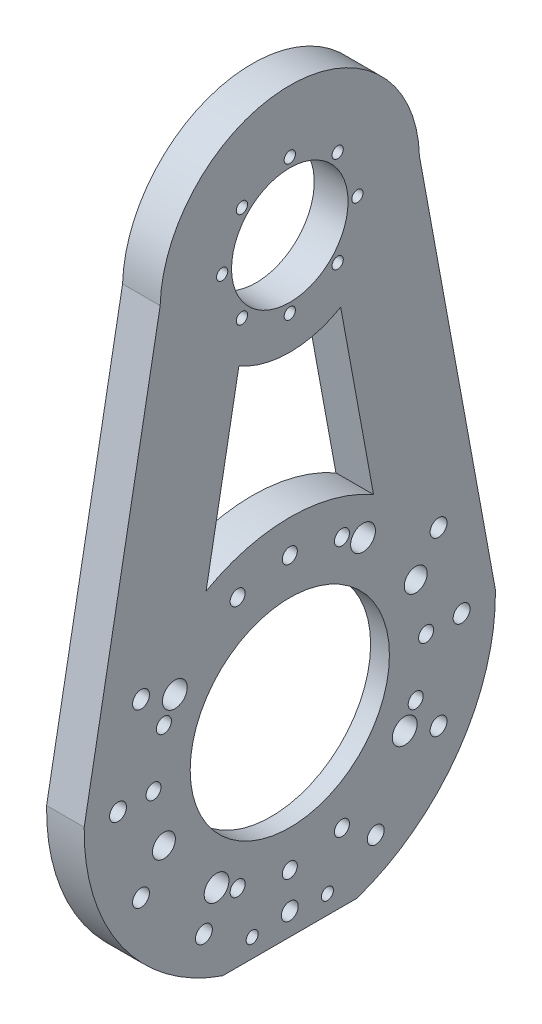
from build123d import *

# Parameters (mm, degrees)
SKETCH2_R                       = 40.5
SKETCH2_R_2                     = 15.5
BOSS_EXTRUDE1_DEPTH             = 5
BOSS_EXTRUDE2_START             = -5
SKETCH2_5_R                     = 40.5
SKETCH2_5_R_2                   = 15.5
BOSS_EXTRUDE2_DEPTH             = 5
FILLET3_R                       = 1
SKETCH12_R                      = 1.5
CUT_EXTRUDE12_DEPTH             = 191.422110061
CIRPATTERN1_COUNT               = 8
SKETCH13_R                      = 21.5
CUT_EXTRUDE13_DEPTH             = 1
CUT_EXTRUDE16_DEPTH             = 10
SKETCH16_W                      = 105.253324721
SKETCH16_H                      = 10.065806818
CUT_EXTRUDE17_DEPTH             = 10
CUT_EXTRUDE20_DEPTH             = 155.830035846
SKETCH29_R                      = 1.6
CUT_EXTRUDE21_DEPTH             = 10
SKETCH31_R                      = 2.25
CUT_EXTRUDE22_DEPTH             = 10
CIRPATTERN2_COUNT               = 5
CIRPATTERN2_ANGLE               = 120
CIRPATTERN2_THE_OTHER_WAY_COUNT = 5
CIRPATTERN2_THE_OTHER_WAY_ANGLE = 120


with BuildPart() as part:
    # Sketch2 → Boss-Extrude1 (new body)
    # profile 1 of 2: a face of its own
    with BuildSketch(Plane(origin=(0, 0, 0), x_dir=(0, 0, -1), z_dir=(1, 0, 0))):
        with BuildLine():
            Line((-67.7, 110), (-67.7, 0))
            Line((-67.7, 0), (-67.7, -68))
            Line((-67.7, -68), (67.7, -68))
            Line((67.7, -68), (67.7, 10))
            Line((67.7, 10), (67.7, 110))
            ThreePointArc((67.7, 110), (0, 177.7), (-67.7, 110))
        make_face()
        Circle(SKETCH2_R, mode=Mode.SUBTRACT)
        with Locations((0, 110)):
            Circle(SKETCH2_R_2, mode=Mode.SUBTRACT)
    # profile 2 of 2: a face of its own
    with BuildSketch(Plane(origin=(0, 0, 0), x_dir=(0, 0, -1), z_dir=(1, 0, 0))):
        Circle(SKETCH2_R)
        with BuildLine():
            ThreePointArc((-17.143658425, -32.906392289), (-21.81056318, -32.906392289), (-21.81056318, -28.239487533))
            ThreePointArc((-21.81056318, -28.239487533), (-17.143658425, -28.239487533), (-17.143658425, -32.906392289))
        make_face(mode=Mode.SUBTRACT)
        with BuildLine():
            ThreePointArc((-35.647308736, -11.715598741), (-31.333957371, -11.715598741), (-31.333957371, -16.028950106))
            ThreePointArc((-31.333957371, -16.028950106), (-35.647308736, -16.028950106), (-35.647308736, -11.715598741))
        make_face(mode=Mode.SUBTRACT)
        with BuildLine():
            ThreePointArc((-12.458060861, -34.904846616), (-15.286487986, -34.904846616), (-15.286487986, -32.076419491))
            ThreePointArc((-15.286487986, -32.076419491), (-12.458060861, -32.076419491), (-12.458060861, -34.904846616))
        make_face(mode=Mode.SUBTRACT)
        with BuildLine():
            ThreePointArc((-37.664213562, 1.414213562), (-34.835786438, 1.414213562), (-34.835786438, -1.414213562))
            ThreePointArc((-34.835786438, -1.414213562), (-37.664213562, -1.414213562), (-37.664213562, 1.414213562))
        make_face(mode=Mode.SUBTRACT)
        with BuildLine():
            ThreePointArc((-32.076419491, 12.458060861), (-34.904846616, 12.458060861), (-34.904846616, 15.286487986))
            ThreePointArc((-34.904846616, 15.286487986), (-32.076419491, 15.286487986), (-32.076419491, 12.458060861))
        make_face(mode=Mode.SUBTRACT)
        with BuildLine():
            ThreePointArc((-28.239487533, 17.143658425), (-32.906392289, 17.143658425), (-32.906392289, 21.81056318))
            ThreePointArc((-32.906392289, 21.81056318), (-28.239487533, 21.81056318), (-28.239487533, 17.143658425))
        make_face(mode=Mode.SUBTRACT)
        with BuildLine():
            ThreePointArc((-15.286487986, 34.904846616), (-12.458060861, 34.904846616), (-12.458060861, 32.076419491))
            ThreePointArc((-12.458060861, 32.076419491), (-15.286487986, 32.076419491), (-15.286487986, 34.904846616))
        make_face(mode=Mode.SUBTRACT)
        with BuildLine():
            ThreePointArc((-1.414213562, 37.664213562), (1.414213562, 37.664213562), (1.414213562, 34.835786438))
            ThreePointArc((1.414213562, 34.835786438), (-1.414213562, 34.835786438), (-1.414213562, 37.664213562))
        make_face(mode=Mode.SUBTRACT)
        with BuildLine():
            ThreePointArc((-1.414213562, -34.835786438), (1.414213562, -34.835786438), (1.414213562, -37.664213562))
            ThreePointArc((1.414213562, -37.664213562), (-1.414213562, -37.664213562), (-1.414213562, -34.835786438))
        make_face(mode=Mode.SUBTRACT)
        with BuildLine():
            ThreePointArc((12.458060861, -32.076419491), (15.286487986, -32.076419491), (15.286487986, -34.904846616))
            ThreePointArc((15.286487986, -34.904846616), (12.458060861, -34.904846616), (12.458060861, -32.076419491))
        make_face(mode=Mode.SUBTRACT)
        with BuildLine():
            ThreePointArc((32.906392289, -21.81056318), (28.239487533, -21.81056318), (28.239487533, -17.143658425))
            ThreePointArc((28.239487533, -17.143658425), (32.906392289, -17.143658425), (32.906392289, -21.81056318))
        make_face(mode=Mode.SUBTRACT)
        with BuildLine():
            ThreePointArc((34.904846616, -15.286487986), (32.076419491, -15.286487986), (32.076419491, -12.458060861))
            ThreePointArc((32.076419491, -12.458060861), (34.904846616, -12.458060861), (34.904846616, -15.286487986))
        make_face(mode=Mode.SUBTRACT)
        with BuildLine():
            ThreePointArc((16.292073099, 20.900199859), (20.900199859, -16.292073099), (-16.292073099, -20.900199859))
            ThreePointArc((-16.292073099, -20.900199859), (-20.900199859, 16.292073099), (16.292073099, 20.900199859))
        make_face(mode=Mode.SUBTRACT)
        with BuildLine():
            ThreePointArc((35.647308736, 11.715598741), (31.333957371, 11.715598741), (31.333957371, 16.028950106))
            ThreePointArc((31.333957371, 16.028950106), (35.647308736, 16.028950106), (35.647308736, 11.715598741))
        make_face(mode=Mode.SUBTRACT)
        with BuildLine():
            ThreePointArc((12.458060861, 34.904846616), (15.286487986, 34.904846616), (15.286487986, 32.076419491))
            ThreePointArc((15.286487986, 32.076419491), (12.458060861, 32.076419491), (12.458060861, 34.904846616))
        make_face(mode=Mode.SUBTRACT)
        with BuildLine():
            ThreePointArc((21.81056318, 28.239487533), (17.143658425, 28.239487533), (17.143658425, 32.906392289))
            ThreePointArc((17.143658425, 32.906392289), (21.81056318, 32.906392289), (21.81056318, 28.239487533))
        make_face(mode=Mode.SUBTRACT)
        with BuildLine():
            ThreePointArc((34.835786438, 1.414213562), (37.664213562, 1.414213562), (37.664213562, -1.414213562))
            ThreePointArc((37.664213562, -1.414213562), (34.835786438, -1.414213562), (34.835786438, 1.414213562))
        make_face(mode=Mode.SUBTRACT)
    extrude(amount=BOSS_EXTRUDE1_DEPTH)

    # Sketch2<5> → Boss-Extrude2 (add)
    with BuildSketch(Plane(origin=(0, 0, 0), x_dir=(0, 0, -1), z_dir=(1, 0, 0)).offset(BOSS_EXTRUDE2_START)):
        with BuildLine():
            Line((-67.7, 110), (-67.7, 0))
            Line((-67.7, 0), (-67.7, -68))
            Line((-67.7, -68), (67.7, -68))
            Line((67.7, -68), (67.7, 10))
            Line((67.7, 10), (67.7, 110))
            ThreePointArc((67.7, 110), (0, 177.7), (-67.7, 110))
        make_face()
        Circle(SKETCH2_5_R, mode=Mode.SUBTRACT)
        with Locations((0, 110)):
            Circle(SKETCH2_5_R_2, mode=Mode.SUBTRACT)
    extrude(amount=BOSS_EXTRUDE2_DEPTH)

    # Fillet3
    fillet3_edges = [part.edges().sort_by_distance(p)[0] for p in [
        (-5, 0, 40.5),
    ]]
    fillet(fillet3_edges, radius=FILLET3_R)

    # Sketch12 → Cut-Extrude12 (cut, through all)
    with BuildSketch(Plane.ZY.offset(5)):
        with Locations((-0.00151734, 127.999999936)):
            Circle(SKETCH12_R)
    cut_extrude12 = extrude(amount=-CUT_EXTRUDE12_DEPTH, mode=Mode.SUBTRACT)

    # CirPattern1: Cut-Extrude12 ×8 about axis
    cirpattern1_axis = Axis((0, 110, 0), (1, 0, 0))
    for i in range(1, CIRPATTERN1_COUNT):
        add(cut_extrude12.rotate(cirpattern1_axis, i * 360 / CIRPATTERN1_COUNT), mode=Mode.SUBTRACT)

    # Sketch13 → Cut-Extrude13 (cut)
    with BuildSketch(Plane.ZY.offset(5)):
        with Locations((0, 110)):
            Circle(SKETCH13_R)
    extrude(amount=-CUT_EXTRUDE13_DEPTH, mode=Mode.SUBTRACT)

    # Sketch15 → Cut-Extrude16 (cut)
    with BuildSketch(Plane.ZY.offset(5)):
        with BuildLine():
            ThreePointArc((67.7, 110), (0, 177.7), (-67.7, 110))
            Line((-67.7, 110), (-67.7, -68))
            Line((-67.7, -68), (67.7, -68))
            Line((67.7, -68), (67.7, 110))
        make_face()
        with BuildLine():
            ThreePointArc((-54.691644033, 0.956071637), (0, -54.7), (54.691644033, 0.956071637))
            Line((54.691644033, 0.956071637), (34.485862883, 110.987553146))
            ThreePointArc((34.485862883, 110.987553146), (0, 144.5), (-34.485862883, 110.987553146))
            Line((-34.485862883, 110.987553146), (-54.691644033, 0.956071637))
        make_face(mode=Mode.SUBTRACT)
    extrude(amount=-CUT_EXTRUDE16_DEPTH, mode=Mode.SUBTRACT)

    # Sketch16 → Cut-Extrude17 (cut)
    with BuildSketch(Plane.ZY.offset(5)):
        with Locations((1.105505895, -56.732903409)):
            Rectangle(SKETCH16_W, SKETCH16_H)
    extrude(amount=-CUT_EXTRUDE17_DEPTH, mode=Mode.SUBTRACT)

    # Sketch19 → Cut-Extrude20 (cut, through all)
    with BuildSketch(Plane(origin=(5, 0, 0), x_dir=(0, 0, -1), z_dir=(1, 0, 0))):
        with BuildLine():
            ThreePointArc((22.268259026, 39.104023322), (0, 45), (-22.268259026, 39.104023322))
            Line((-22.268259026, 39.104023322), (-13.538953214, 86.63984705))
            ThreePointArc((-13.538953214, 86.63984705), (0, 83), (13.538953214, 86.63984705))
            Line((13.538953214, 86.63984705), (22.268259026, 39.104023322))
        make_face()
    extrude(amount=-CUT_EXTRUDE20_DEPTH, mode=Mode.SUBTRACT)

    # Sketch29 → Cut-Extrude21 (cut)
    with BuildSketch(Plane(origin=(5, 0, 0), x_dir=(0, 0, -1), z_dir=(1, 0, 0))):
        with Locations((-10, -46.7)):
            Circle(SKETCH29_R)
        with Locations((10, -46.7)):
            Circle(SKETCH29_R)
    extrude(amount=-CUT_EXTRUDE21_DEPTH, mode=Mode.SUBTRACT)

    # Sketch31 → Cut-Extrude22 (cut)
    with BuildSketch(Plane(origin=(5, 0, 0), x_dir=(0, 0, -1), z_dir=(1, 0, 0))):
        with Locations((0, -45.7)):
            Circle(SKETCH31_R)
    cut_extrude22 = extrude(amount=-CUT_EXTRUDE22_DEPTH, mode=Mode.SUBTRACT)

    # CirPattern2: Cut-Extrude22 ×5 about axis
    cirpattern2_axis = Axis((0, 0, 0), (-1, 0, 0))
    for i in range(1, CIRPATTERN2_COUNT):
        add(cut_extrude22.rotate(cirpattern2_axis, i * CIRPATTERN2_ANGLE / (CIRPATTERN2_COUNT - 1)), mode=Mode.SUBTRACT)

    # CirPattern2 the other way: Cut-Extrude22 ×5 about axis
    cirpattern2_the_other_way_axis = Axis((0, 0, 0), (1, 0, 0))
    for i in range(1, CIRPATTERN2_THE_OTHER_WAY_COUNT):
        add(cut_extrude22.rotate(cirpattern2_the_other_way_axis, i * CIRPATTERN2_THE_OTHER_WAY_ANGLE / (CIRPATTERN2_THE_OTHER_WAY_COUNT - 1)), mode=Mode.SUBTRACT)


solid = part.part
